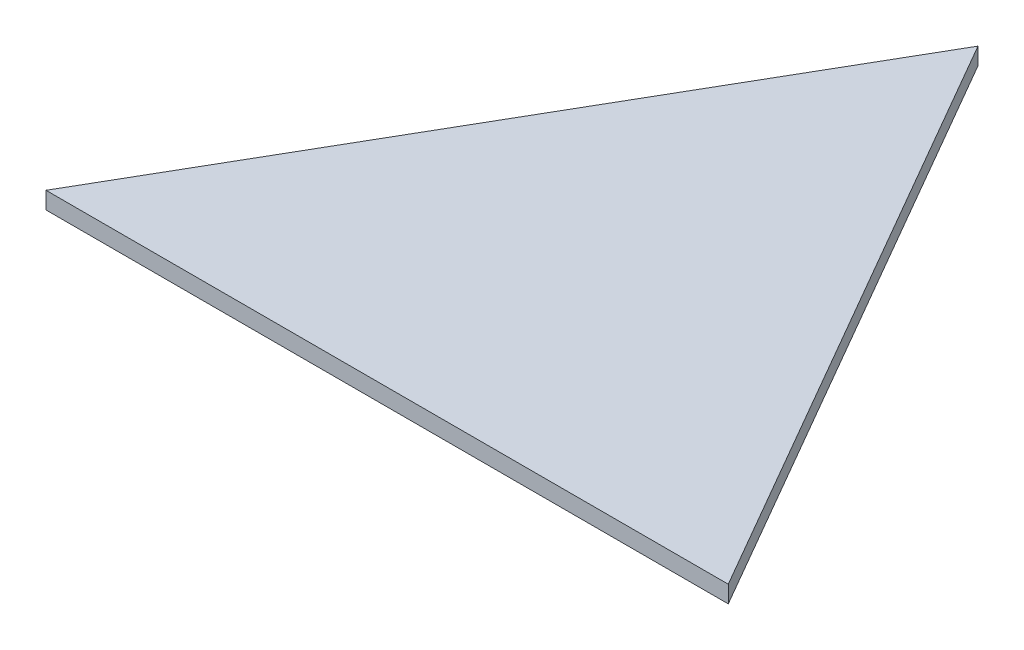
from build123d import *

# Parameters (mm, degrees)
BOSS_EXTRUDE1_DEPTH = 6.35


with BuildPart() as part:
    # Sketch1 → Boss-Extrude1 (new body)
    with BuildSketch(Plane(origin=(0, 0, 0), x_dir=(1, 0, 0), z_dir=(0, 1, 0))):
        Polygon((0, 146.646968374), (-127, -73.323484187), (127, -73.323484187), align=None)
    extrude(amount=BOSS_EXTRUDE1_DEPTH)


solid = part.part
